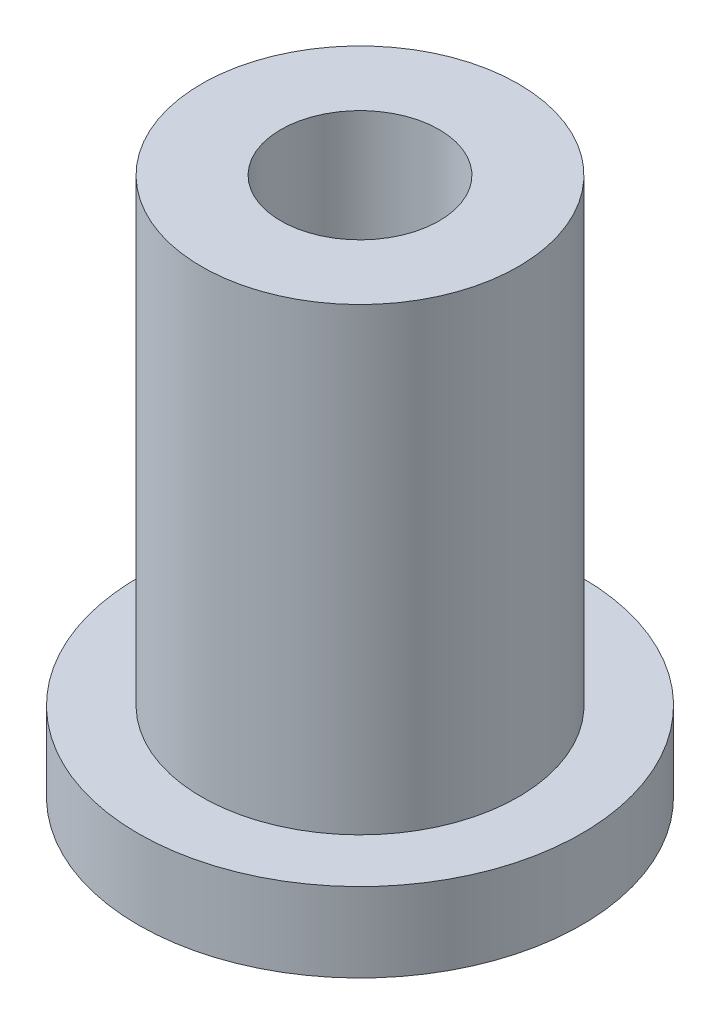
from build123d import *


with BuildPart() as part:
    # Esquisse1 → Révolution1 (revolve)
    with BuildSketch(Plane.XY, mode=Mode.PRIVATE) as r_volution1_sk:
        Polygon((-5, 0), (-5, 34), (-10, 34), (-10, 5), (-14, 5), (-14, 0), align=None)
    revolve(r_volution1_sk.sketch.rotate(Axis((0, 0, 0), (0, 1, 0)), 270), axis=Axis((0, 0, 0), (0, 1, 0)))


solid = part.part
